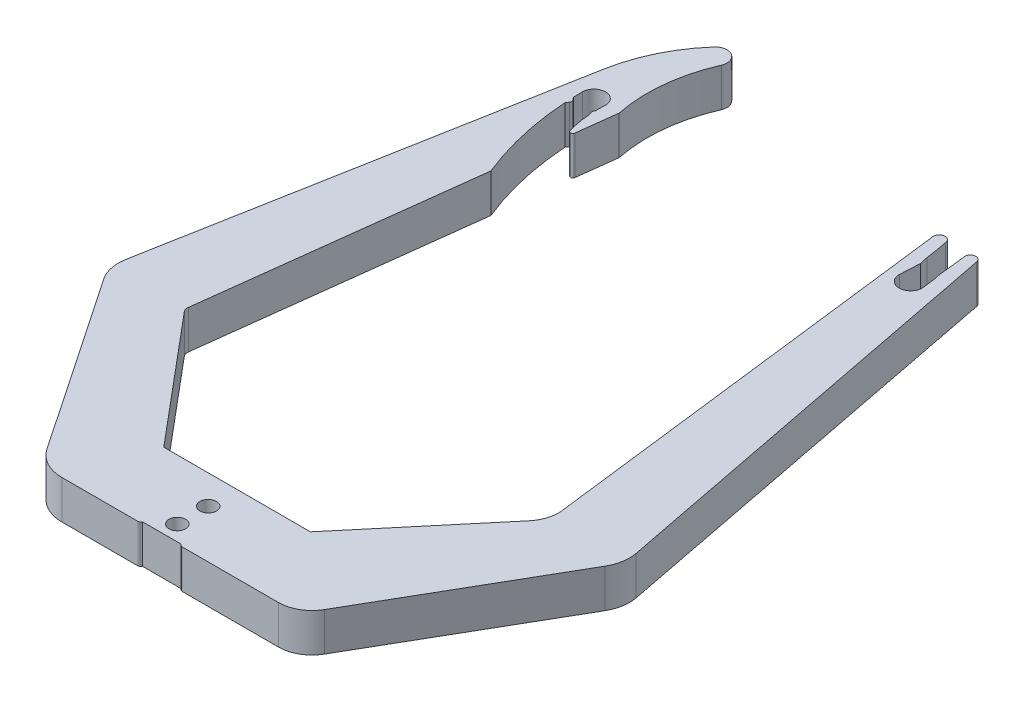
from build123d import *

# Parameters (mm, degrees)
EXTRUDE_1_DEPTH     = 10
CUT_EXTRUDE_1_REACH = 177.427
SKETCH_2_R          = 2.15
FILLET_1_R          = 0.6


with BuildPart() as part:
    # 草图1 → 凸台-拉伸1 (new body)
    with BuildSketch(Plane(origin=(0, 0, 0), x_dir=(1, 0, 0), z_dir=(0, 1, 0))):
        with BuildLine():
            Line((-19, 0), (19, 0))
            Line((19, 0), (44.854614973, 30.81233028))
            ThreePointArc((44.854614973, 30.81233028), (46.529317931, 33.929104052), (46.82231051, 37.455159084))
            Line((46.82231051, 37.455159084), (33.389549678, 146.856216784))
            ThreePointArc((33.389549678, 146.856216784), (34.753999407, 148.533855984), (36.376927445, 147.104765038))
            ThreePointArc((36.376927445, 147.104765038), (36.892496808, 144.296291333), (37.320815542, 141.473193853))
            Line((37.320815542, 141.473193853), (37.815132232, 139.258398169))
            ThreePointArc((37.815132232, 139.258398169), (37.817176658, 139.245056143), (37.817405692, 139.231560332))
            Line((37.817405692, 139.231560332), (37.557917484, 134.104765038))
            ThreePointArc((37.557917484, 134.104765038), (40.754926912, 130.959847465), (43.503129215, 134.503681536))
            Line((43.503129215, 134.503681536), (43.077003941, 137.813685213))
            Line((43.077003941, 137.813685213), (42.807637334, 138.925557366))
            ThreePointArc((42.807637334, 138.925557366), (42.806315787, 138.931905108), (42.80540838, 138.938325149))
            Line((42.80540838, 138.938325149), (42.129277547, 145.175318139))
            Line((42.129277547, 145.175318139), (41.965181023, 146.44996701))
            ThreePointArc((41.965181023, 146.44996701), (43.130662006, 148.010841711), (44.727999785, 146.895858405))
            Line((44.727999785, 146.895858405), (66.016482503, 37.376109146))
            ThreePointArc((66.016482503, 37.376109146), (66.063066684, 33.817543133), (64.860464706, 30.468019192))
            Line((64.860464706, 30.468019192), (38.23055697, -15.656334008))
            ThreePointArc((38.23055697, -15.656334008), (35.050772773, -18.836118205), (30.707106781, -20))
            Line((30.707106781, -20), (5.707106781, -20))
            ThreePointArc((5.707106781, -20), (5.515765065, -19.961939766), (5.353553391, -19.853553391))
            Line((5.353553391, -19.853553391), (5, -19.5))
            Line((5, -19.5), (-5, -19.5))
            Line((-5, -19.5), (-5.353553391, -19.853553391))
            ThreePointArc((-5.353553391, -19.853553391), (-5.515765065, -19.961939766), (-5.707106781, -20))
            Line((-5.707106781, -20), (-25.399802658, -20))
            ThreePointArc((-25.399802658, -20), (-30.087775174, -18.833058003), (-33.681629288, -15.604582738))
            Line((-33.681629288, -15.604582738), (-64.860464706, 30.468019192))
            ThreePointArc((-64.860464706, 30.468019192), (-66.063066684, 33.817543133), (-66.016482503, 37.376109146))
            Line((-66.016482503, 37.376109146), (-46.829620455, 141.890886738))
            ThreePointArc((-46.829620455, 141.890886738), (-43.465252598, 152.148967586), (-37.480163066, 161.13372674))
            ThreePointArc((-37.480163066, 161.13372674), (-33.620696298, 161.680216975), (-32.479267504, 157.953116813))
            ThreePointArc((-32.479267504, 157.953116813), (-35.579400499, 146.14570295), (-34.973851142, 133.953116813))
            Line((-34.973851142, 133.953116813), (-47.176674229, 34.569098196))
            ThreePointArc((-47.176674229, 34.569098196), (-47.109221395, 33.75732882), (-46.723670812, 33.03978429))
            Line((-46.723670812, 33.03978429), (-19, 0))
        make_face()
    extrude(amount=EXTRUDE_1_DEPTH)

    # 草图2 → 切除-拉伸1 (cut, up to next)
    with BuildSketch(Plane(origin=(0, 10, 0), x_dir=(1, 0, 0), z_dir=(0, 1, 0)), mode=Mode.PRIVATE) as cut_extrude_1_sk1:
        with Locations(Location((0, -15.5, 0), (0, 0, 270))):
            Circle(SKETCH_2_R)
    cut_extrude_1_tool1 = extrude(cut_extrude_1_sk1.sketch, amount=-CUT_EXTRUDE_1_REACH, mode=Mode.PRIVATE) & part.part
    # 草图2 → 切除-拉伸1 (cut, up to next)
    with BuildSketch(Plane(origin=(0, 10, 0), x_dir=(1, 0, 0), z_dir=(0, 1, 0)), mode=Mode.PRIVATE) as cut_extrude_1_sk2:
        with Locations(Location((0, -7.5, 0), (0, 0, 270))):
            Circle(SKETCH_2_R)
    cut_extrude_1_tool2 = extrude(cut_extrude_1_sk2.sketch, amount=-CUT_EXTRUDE_1_REACH, mode=Mode.PRIVATE) & part.part
    # 草图2 → 切除-拉伸1 (cut, up to next)
    with BuildSketch(Plane(origin=(0, 10, 0), x_dir=(1, 0, 0), z_dir=(0, 1, 0)), mode=Mode.PRIVATE) as cut_extrude_1_sk3:
        with BuildLine():
            Line((-36.549558395, 121.120011078), (-38.607748185, 104.35740041))
            ThreePointArc((-38.607748185, 104.35740041), (-42.47341142, 116.594845153), (-44.332546284, 129.292956179))
            Line((-44.332546284, 129.292956179), (-43.845113062, 129.987442667))
            ThreePointArc((-43.845113062, 129.987442667), (-43.702378092, 130.509625408), (-43.924830211, 131.003146575))
            Line((-43.924830211, 131.003146575), (-44.447419993, 131.543571067))
            ThreePointArc((-44.447419993, 131.543571067), (-44.482588605, 132.737575539), (-44.499925482, 133.931972015))
            ThreePointArc((-44.499925482, 133.931972015), (-41.418283025, 136.952003662), (-38.505677682, 133.768634142))
            ThreePointArc((-38.505677682, 133.768634142), (-38.556072369, 132.542586282), (-38.556286633, 131.315503182))
            Line((-38.556286633, 131.315503182), (-38.546052546, 131.325051295))
            ThreePointArc((-38.546052546, 131.325051295), (-38.780683801, 130.91622187), (-38.744387532, 130.446247504))
            Line((-38.744387532, 130.446247504), (-38.486748585, 129.793872308))
            ThreePointArc((-38.486748585, 129.793872308), (-37.841140795, 125.384806825), (-36.549558395, 121.120011078))
        make_face()
    cut_extrude_1_tool3 = extrude(cut_extrude_1_sk3.sketch, amount=-CUT_EXTRUDE_1_REACH, mode=Mode.PRIVATE) & part.part
    add(cut_extrude_1_tool1.solids().sort_by_distance((0, 10, 15.5))[0], mode=Mode.SUBTRACT)
    add(cut_extrude_1_tool2.solids().sort_by_distance((0, 10, 7.5))[0], mode=Mode.SUBTRACT)
    add(cut_extrude_1_tool3.solids().sort_by_distance((-40.502089, 10, -123.156617))[0], mode=Mode.SUBTRACT)

    # 圆角1
    fillet_1_edges = [part.edges().sort_by_distance(p)[0] for p in [
        (-36.549558395, 5, -121.120011078),
        (-34.973851142, 5, -133.953116813),
    ]]
    fillet(fillet_1_edges, radius=FILLET_1_R)


solid = part.part
